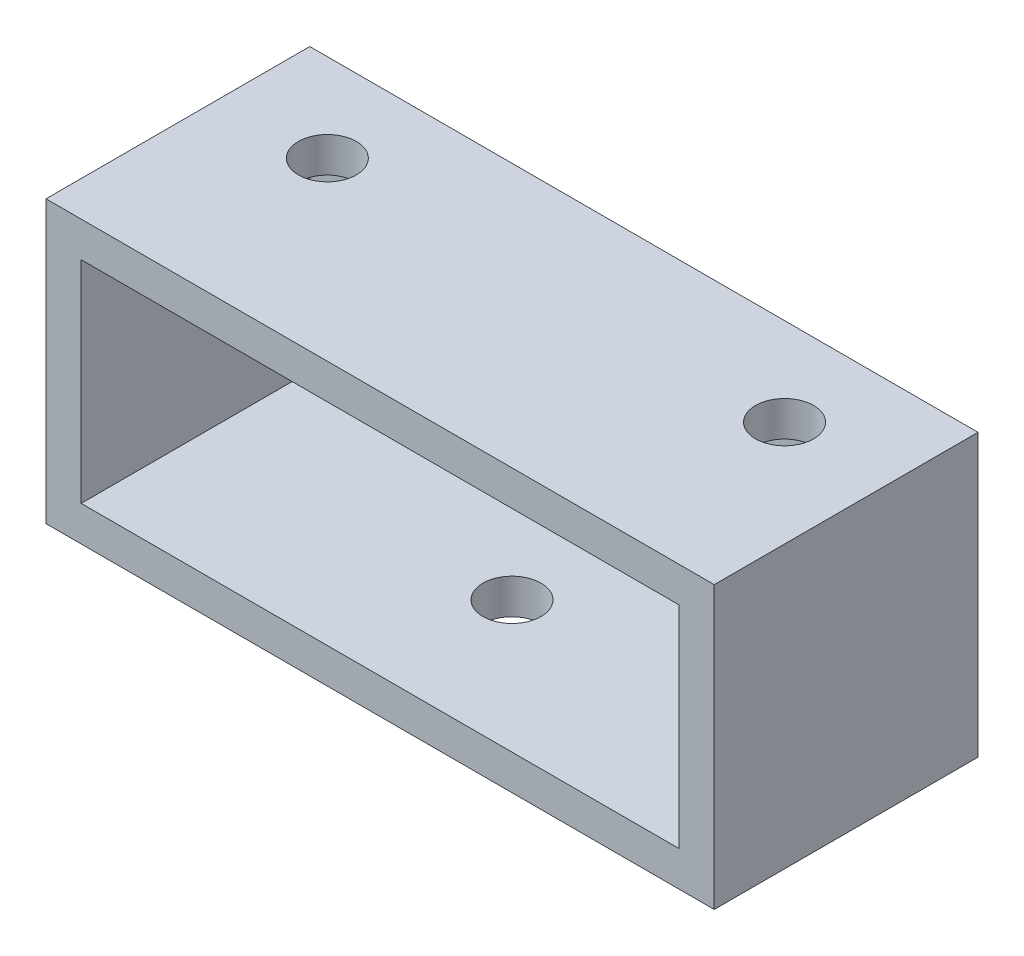
from build123d import *

# Parameters (mm, degrees)
SKETCH_1_W          = 38
SKETCH_1_H          = 15
EXTRUDE_1_DEPTH     = 16
SKETCH_2_W          = 34
SKETCH_2_H          = 12
CUT_EXTRUDE_1_DEPTH = 13
SKETCH_3_R          = 1.65
CUT_EXTRUDE_2_DEPTH = 2
SKETCH_4_R          = 1.65
CUT_EXTRUDE_3_DEPTH = 10


with BuildPart() as part:
    # 草图1 → 凸台-拉伸1 (new body)
    with BuildSketch(Plane(origin=(0, 0, 0), x_dir=(1, 0, 0), z_dir=(0, 1, 0))):
        with Locations((19, 7.5)):
            Rectangle(SKETCH_1_W, SKETCH_1_H)
    extrude(amount=EXTRUDE_1_DEPTH)

    # 草图2 → 切除-拉伸1 (cut)
    with BuildSketch(Plane.XY):
        with Locations((19, 8)):
            Rectangle(SKETCH_2_W, SKETCH_2_H)
    extrude(amount=-CUT_EXTRUDE_1_DEPTH, mode=Mode.SUBTRACT)

    # 草图3 → 切除-拉伸2 (cut)
    with BuildSketch(Plane(origin=(0, 16, 0), x_dir=(1, 0, 0), z_dir=(0, 1, 0))):
        with Locations(Location((6, 10, 0), (0, 0, 270))):
            Circle(SKETCH_3_R)
        with Locations(Location((32, 10, 0), (0, 0, 90))):
            Circle(SKETCH_3_R)
    extrude(amount=-CUT_EXTRUDE_2_DEPTH, mode=Mode.SUBTRACT)

    # 草图4 → 切除-拉伸3 (cut)
    with BuildSketch(Plane(origin=(0, 2, 0), x_dir=(1, 0, 0), z_dir=(0, 1, 0))):
        with Locations(Location((19, 7.5, 0), (0, 0, 270))):
            Circle(SKETCH_4_R)
        with Locations(Location((32, 7.5, 0), (0, 0, 270))):
            Circle(SKETCH_4_R)
    extrude(amount=-CUT_EXTRUDE_3_DEPTH, mode=Mode.SUBTRACT)


solid = part.part
